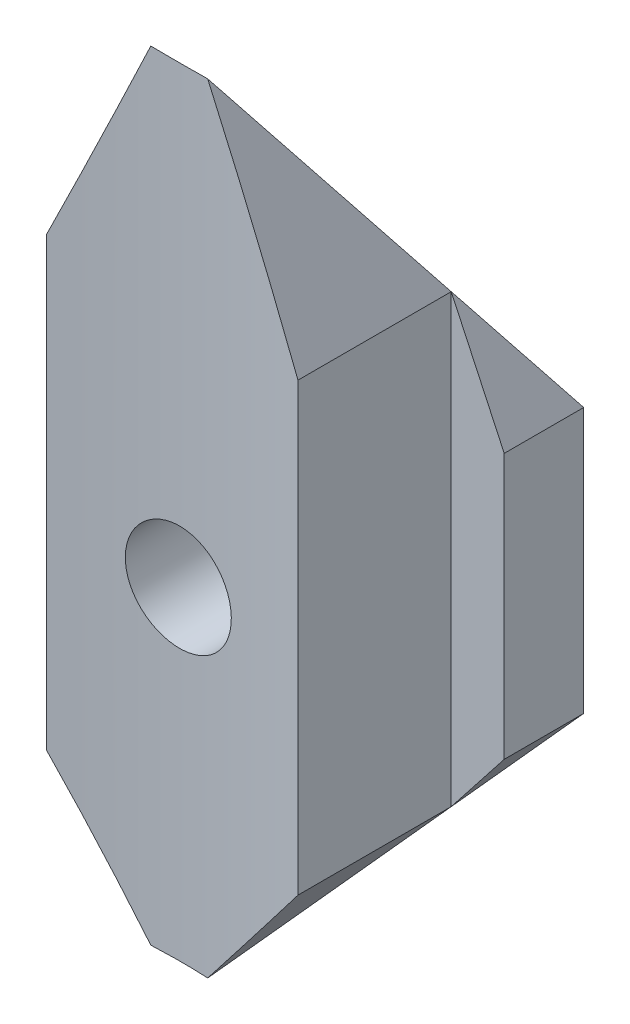
from build123d import *

# Parameters (mm, degrees)
BOSS_EXTRUDE1_DEPTH = 30
SKETCH2_OUTSIDE_W   = 17.593
SKETCH2_OUTSIDE_H   = 38.81
CUT_EXTRUDE1_DEPTH  = 15
SKETCH3_OUTSIDE_W   = 22.31
SKETCH3_OUTSIDE_H   = 38.81
SKETCH3_OUTSIDE_R   = 2
CUT_EXTRUDE2_DEPTH  = 15


with BuildPart() as part:
    # Sketch1 → Boss-Extrude1 (new body)
    with BuildSketch(Plane(origin=(0, 0, 0), x_dir=(1, 0, 0), z_dir=(0, 1, 0))):
        with BuildLine():
            Line((-4.75, -0.283032593), (-4.75, 5.5))
            Line((-4.75, 5.5), (-6.75, 5.5))
            Line((-6.75, 5.5), (-6.75, 8.5))
            Line((-6.75, 8.5), (6.75, 8.5))
            Line((6.75, 8.5), (6.75, 5.5))
            Line((6.75, 5.5), (4.75, 5.5))
            Line((4.75, 5.5), (4.75, -0.283032593))
            ThreePointArc((4.75, -0.283032593), (0, 0), (-4.75, -0.283032593))
        make_face()
    extrude(amount=BOSS_EXTRUDE1_DEPTH)

    # Sketch2 outside → Cut-Extrude1 (cut)
    with BuildSketch(Plane(origin=(6.75, 0, 0), x_dir=(0, 0, -1), z_dir=(1, 0, 0))):
        with Locations((4.1085, 15)):
            Rectangle(SKETCH2_OUTSIDE_W, SKETCH2_OUTSIDE_H)
        Polygon((-0.283032593, 30), (8.5, 17.456529509), (8.5, 7.456529509), (-0.283032593, 0), align=None, mode=Mode.SUBTRACT)
    extrude(amount=-CUT_EXTRUDE1_DEPTH, mode=Mode.SUBTRACT)

    # Sketch3 outside → Cut-Extrude2 (cut)
    # profile 1 of 2: a face of its own
    with BuildSketch(Plane(origin=(0, 0, -8.5), x_dir=(-1, 0, 0), z_dir=(0, 0, -1))):
        with Locations((0, 15)):
            Rectangle(SKETCH3_OUTSIDE_W, SKETCH3_OUTSIDE_H)
        Polygon((-6.75, 17.456529509), (-0.894644938, 30), (0.894644938, 30), (6.75, 17.456529509), (6.75, 7.456529509), (0.894644938, 0), (-0.894644938, 0), (-6.75, 7.456529509), align=None, mode=Mode.SUBTRACT)
    # profile 2 of 2: a face of its own
    with BuildSketch(Plane(origin=(0, 0, -8.5), x_dir=(-1, 0, 0), z_dir=(0, 0, -1))):
        with Locations((0, 12.456529509)):
            Circle(SKETCH3_OUTSIDE_R)
    extrude(amount=-CUT_EXTRUDE2_DEPTH, mode=Mode.SUBTRACT)


solid = part.part
